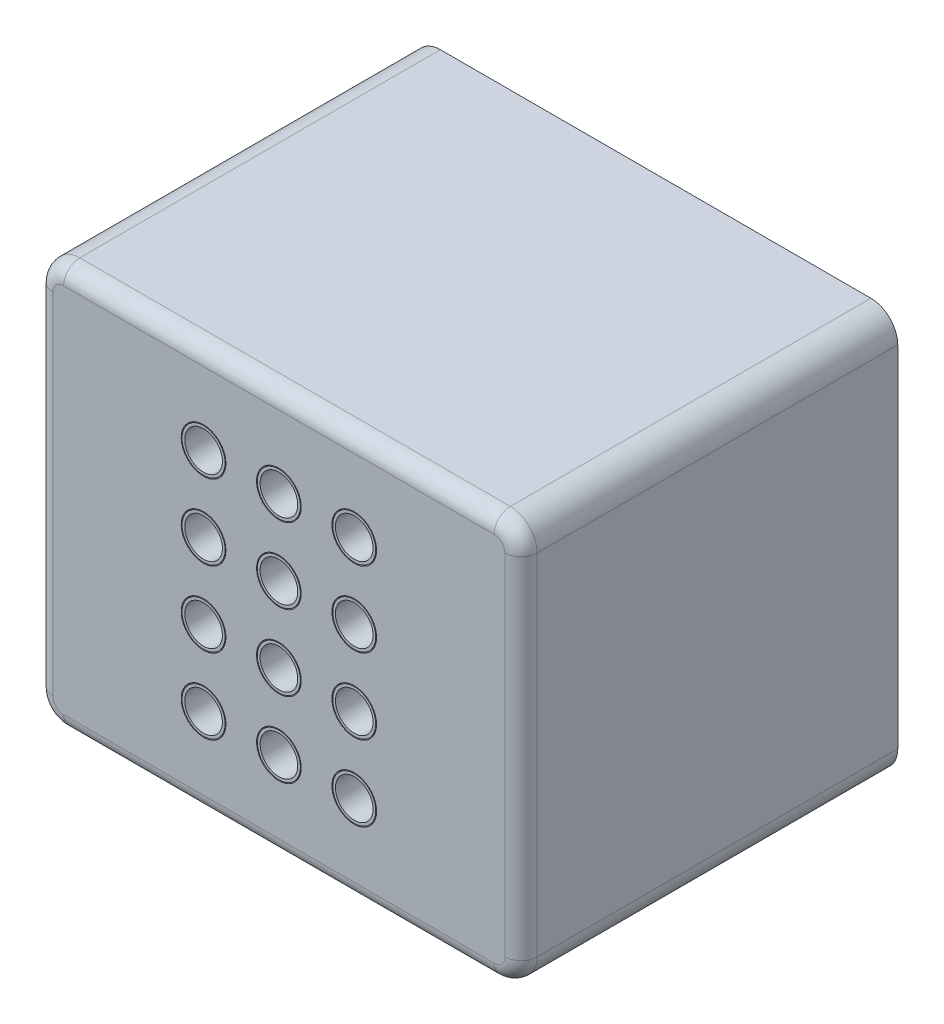
from build123d import *
from build123d.topology import SkipClean

# Parameters (mm, degrees)
SKETCH_1_W           = 90
SKETCH_1_H           = 75
EXTRUDE_1_DEPTH      = 43
SKETCH_2_R           = 4.15
CUT_EXTRUDE_3_DEPTH  = 80
SKETCH_8_W           = 85
SKETCH_8_H           = 70
CUT_EXTRUDE_4_DEPTH  = 37
SKETCH_9_R           = 6.5
SKETCH_9_R_2         = 4
EXTRUDE_5_DEPTH      = 22
SKETCH_12_W          = 3
SKETCH_12_H          = 10
CUT_EXTRUDE_5_DEPTH  = 4
SKETCH_13_R          = 4
SKETCH_13_R_2        = 1.25
EXTRUDE_7_DEPTH      = 22
SKETCH_15_R          = 4
SKETCH_15_R_2        = 3.5
EXTRUDE_8_DEPTH      = 5.8
EXTRUDE_8_2_DEPTH    = 5.8
EXTRUDE_8_3_DEPTH    = 5.8
EXTRUDE_8_4_DEPTH    = 5.8
EXTRUDE_8_5_DEPTH    = 5.8
EXTRUDE_8_6_DEPTH    = 5.8
EXTRUDE_8_7_DEPTH    = 5.8
EXTRUDE_8_8_DEPTH    = 5.8
EXTRUDE_8_9_DEPTH    = 5.8
EXTRUDE_8_10_DEPTH   = 5.8
EXTRUDE_8_11_DEPTH   = 5.8
EXTRUDE_8_12_DEPTH   = 5.8
FILLET_1_R           = 5
SKETCH_16_R          = 4.535533906
SKETCH_16_R_2        = 1.4
EXTRUDE_9_DEPTH      = 37
SKETCH_17_R          = 1.4
CUT_EXTRUDE_7_DEPTH  = 27
FILLET_3_R           = 3
SKETCH_18_R          = 6.5
CUT_EXTRUDE_8_DEPTH  = 10
SKETCH_24_W          = 13.5
SKETCH_24_H          = 8.5
CUT_EXTRUDE_12_DEPTH = 3
SKETCH_26_W          = 3
SKETCH_26_H          = 3
CUT_EXTRUDE_14_DEPTH = 21
EXTRUDE_START        = 27
SKETCH_27_R          = 1.4
EXTRUDE_10_DEPTH     = 27


with BuildPart() as part:
    # 草图1 → 凸台-拉伸1 (new body)
    with BuildSketch(Plane.XY):
        Rectangle(SKETCH_1_W, SKETCH_1_H)
    extrude(amount=EXTRUDE_1_DEPTH)

    # 草图2 → 切除-拉伸3 (cut)
    with BuildSketch(Plane.XY.offset(43)):
        with Locations((0, 7)):
            Circle(SKETCH_2_R)
        with Locations((0, -7)):
            Circle(SKETCH_2_R)
        with Locations((14, 7)):
            Circle(SKETCH_2_R)
        with Locations((14, -7)):
            Circle(SKETCH_2_R)
        with Locations((-14, -7)):
            Circle(SKETCH_2_R)
        with Locations((-14, 7)):
            Circle(SKETCH_2_R)
        with Locations((0, -21)):
            Circle(SKETCH_2_R)
        with Locations((-14, -21)):
            Circle(SKETCH_2_R)
        with Locations((14, -21)):
            Circle(SKETCH_2_R)
        with Locations((-14, 21)):
            Circle(SKETCH_2_R)
        with Locations((0, 21)):
            Circle(SKETCH_2_R)
        with Locations((14, 21)):
            Circle(SKETCH_2_R)
    extrude(amount=-CUT_EXTRUDE_3_DEPTH, mode=Mode.SUBTRACT)

    # 草图8 → 切除-拉伸4 (cut)
    with BuildSketch(Plane(origin=(0, 0, 0), x_dir=(-1, 0, 0), z_dir=(0, 0, -1))):
        Rectangle(SKETCH_8_W, SKETCH_8_H)
    extrude(amount=-CUT_EXTRUDE_4_DEPTH, mode=Mode.SUBTRACT)

    # 草图9 → 凸台-拉伸5 (add)
    # profile 1 of 12: a face of its own
    with BuildSketch(Plane(origin=(0, 0, 37), x_dir=(-1, 0, 0), z_dir=(0, 0, -1))):
        with Locations((-14, 7)):
            Circle(SKETCH_9_R)
        with Locations((-14, 7)):
            Circle(SKETCH_9_R_2, mode=Mode.SUBTRACT)
    # profile 2 of 12: a face of its own
    with BuildSketch(Plane(origin=(0, 0, 37), x_dir=(-1, 0, 0), z_dir=(0, 0, -1))):
        with Locations((0, 7)):
            Circle(SKETCH_9_R)
        with Locations((0, 7)):
            Circle(SKETCH_9_R_2, mode=Mode.SUBTRACT)
    # profile 3 of 12: a face of its own
    with BuildSketch(Plane(origin=(0, 0, 37), x_dir=(-1, 0, 0), z_dir=(0, 0, -1))):
        with Locations((14, 7)):
            Circle(SKETCH_9_R)
        with Locations((14, 7)):
            Circle(SKETCH_9_R_2, mode=Mode.SUBTRACT)
    # profile 4 of 12: a face of its own
    with BuildSketch(Plane(origin=(0, 0, 37), x_dir=(-1, 0, 0), z_dir=(0, 0, -1))):
        with Locations(Location((14, -7, 0), (0, 0, 180))):
            Circle(SKETCH_9_R)
        with Locations(Location((14, -7, 0), (0, 0, 180))):
            Circle(SKETCH_9_R_2, mode=Mode.SUBTRACT)
    # profile 5 of 12: a face of its own
    with BuildSketch(Plane(origin=(0, 0, 37), x_dir=(-1, 0, 0), z_dir=(0, 0, -1))):
        with Locations(Location((0, -7, 0), (0, 0, 180))):
            Circle(SKETCH_9_R)
        with Locations(Location((0, -7, 0), (0, 0, 180))):
            Circle(SKETCH_9_R_2, mode=Mode.SUBTRACT)
    # profile 6 of 12: a face of its own
    with BuildSketch(Plane(origin=(0, 0, 37), x_dir=(-1, 0, 0), z_dir=(0, 0, -1))):
        with Locations(Location((-14, -7, 0), (0, 0, 180))):
            Circle(SKETCH_9_R)
        with Locations(Location((-14, -7, 0), (0, 0, 180))):
            Circle(SKETCH_9_R_2, mode=Mode.SUBTRACT)
    # profile 7 of 12: a face of its own
    with BuildSketch(Plane(origin=(0, 0, 37), x_dir=(-1, 0, 0), z_dir=(0, 0, -1))):
        with Locations((-14, 21)):
            Circle(SKETCH_9_R)
        with Locations((-14, 21)):
            Circle(SKETCH_9_R_2, mode=Mode.SUBTRACT)
    # profile 8 of 12: a face of its own
    with BuildSketch(Plane(origin=(0, 0, 37), x_dir=(-1, 0, 0), z_dir=(0, 0, -1))):
        with Locations((0, 21)):
            Circle(SKETCH_9_R)
        with Locations((0, 21)):
            Circle(SKETCH_9_R_2, mode=Mode.SUBTRACT)
    # profile 9 of 12: a face of its own
    with BuildSketch(Plane(origin=(0, 0, 37), x_dir=(-1, 0, 0), z_dir=(0, 0, -1))):
        with Locations((14, 21)):
            Circle(SKETCH_9_R)
        with Locations((14, 21)):
            Circle(SKETCH_9_R_2, mode=Mode.SUBTRACT)
    # profile 10 of 12: a face of its own
    with BuildSketch(Plane(origin=(0, 0, 37), x_dir=(-1, 0, 0), z_dir=(0, 0, -1))):
        with Locations(Location((14, -21, 0), (0, 0, 180))):
            Circle(SKETCH_9_R)
        with Locations(Location((14, -21, 0), (0, 0, 180))):
            Circle(SKETCH_9_R_2, mode=Mode.SUBTRACT)
    # profile 11 of 12: a face of its own
    with BuildSketch(Plane(origin=(0, 0, 37), x_dir=(-1, 0, 0), z_dir=(0, 0, -1))):
        with Locations(Location((0, -21, 0), (0, 0, 180))):
            Circle(SKETCH_9_R)
        with Locations(Location((0, -21, 0), (0, 0, 180))):
            Circle(SKETCH_9_R_2, mode=Mode.SUBTRACT)
    # profile 12 of 12: a face of its own
    with BuildSketch(Plane(origin=(0, 0, 37), x_dir=(-1, 0, 0), z_dir=(0, 0, -1))):
        with Locations(Location((-14, -21, 0), (0, 0, 180))):
            Circle(SKETCH_9_R)
        with Locations(Location((-14, -21, 0), (0, 0, 180))):
            Circle(SKETCH_9_R_2, mode=Mode.SUBTRACT)
    extrude(amount=EXTRUDE_5_DEPTH)

    # 草图12 → 切除-拉伸5 (cut)
    with BuildSketch(Plane(origin=(0, 0, 15), x_dir=(-1, 0, 0), z_dir=(0, 0, -1))):
        with Locations((0, 13.5)):
            Rectangle(SKETCH_12_W, SKETCH_12_H)
        with Locations((14, 13.5)):
            Rectangle(SKETCH_12_W, SKETCH_12_H)
        with Locations((-14, 13.5)):
            Rectangle(SKETCH_12_W, SKETCH_12_H)
        with Locations((0, -12.5)):
            Rectangle(SKETCH_12_W, SKETCH_12_H)
        with Locations((14, -12.5)):
            Rectangle(SKETCH_12_W, SKETCH_12_H)
        with Locations((-14, -12.5)):
            Rectangle(SKETCH_12_W, SKETCH_12_H)
    extrude(amount=-CUT_EXTRUDE_5_DEPTH, mode=Mode.SUBTRACT)

    # 草图13 → 凸台-拉伸7 (add)
    # profile 1 of 4: a face of its own
    with BuildSketch(Plane(origin=(0, 0, 37), x_dir=(-1, 0, 0), z_dir=(0, 0, -1))):
        with Locations((-7, 0)):
            Circle(SKETCH_13_R)
        with Locations((-7, 0)):
            Circle(SKETCH_13_R_2, mode=Mode.SUBTRACT)
    # profile 2 of 4: a face of its own
    with BuildSketch(Plane(origin=(0, 0, 37), x_dir=(-1, 0, 0), z_dir=(0, 0, -1))):
        with Locations((19, 0)):
            Circle(SKETCH_13_R)
        with Locations(Location((19, 0, 0), (0, 0, 180))):
            Circle(SKETCH_13_R_2, mode=Mode.SUBTRACT)
    # profile 3 of 4: a face of its own
    with BuildSketch(Plane(origin=(0, 0, 37), x_dir=(-1, 0, 0), z_dir=(0, 0, -1))):
        with Locations((7, 0)):
            Circle(SKETCH_13_R)
        with Locations(Location((7, 0, 0), (0, 0, 180))):
            Circle(SKETCH_13_R_2, mode=Mode.SUBTRACT)
    # profile 4 of 4: a face of its own
    with BuildSketch(Plane(origin=(0, 0, 37), x_dir=(-1, 0, 0), z_dir=(0, 0, -1))):
        with Locations((-19, 0)):
            Circle(SKETCH_13_R)
        with Locations((-19, 0)):
            Circle(SKETCH_13_R_2, mode=Mode.SUBTRACT)
    extrude(amount=EXTRUDE_7_DEPTH)

    # 圆角1
    fillet_1_edges = [part.edges().sort_by_distance(p)[0] for p in [
        (45, -37.5, 21.5),
        (-45, -37.5, 21.5),
        (-45, 37.5, 21.5),
        (45, 37.5, 21.5),
        (-42.5, 35, 18.5),
        (-42.5, -35, 18.5),
        (42.5, -35, 18.5),
        (42.5, 35, 18.5),
    ]]
    fillet(fillet_1_edges, radius=FILLET_1_R)

    # 草图16 → 凸台-拉伸9 (add)
    # profile 1 of 4: a face of its own
    with BuildSketch(Plane(origin=(0, 0, 0), x_dir=(-1, 0, 0), z_dir=(0, 0, -1))):
        with Locations((-40.328427125, 32.828427125)):
            Circle(SKETCH_16_R)
        with Locations((-40.328427125, 32.828427125)):
            Circle(SKETCH_16_R_2, mode=Mode.SUBTRACT)
    # profile 2 of 4: a face of its own
    with BuildSketch(Plane(origin=(0, 0, 0), x_dir=(-1, 0, 0), z_dir=(0, 0, -1))):
        with Locations((40.328427125, 32.828427125)):
            Circle(SKETCH_16_R)
        with Locations((40.328427125, 32.828427125)):
            Circle(SKETCH_16_R_2, mode=Mode.SUBTRACT)
    # profile 3 of 4: a face of its own
    with BuildSketch(Plane(origin=(0, 0, 0), x_dir=(-1, 0, 0), z_dir=(0, 0, -1))):
        with Locations((40.328427125, -32.828427125)):
            Circle(SKETCH_16_R)
        with Locations((40.328427125, -32.828427125)):
            Circle(SKETCH_16_R_2, mode=Mode.SUBTRACT)
    # profile 4 of 4: a face of its own
    with BuildSketch(Plane(origin=(0, 0, 0), x_dir=(-1, 0, 0), z_dir=(0, 0, -1))):
        with Locations((-40.328427125, -32.828427125)):
            Circle(SKETCH_16_R)
        with Locations((-40.328427125, -32.828427125)):
            Circle(SKETCH_16_R_2, mode=Mode.SUBTRACT)
    extrude(amount=-EXTRUDE_9_DEPTH)

    # 草图17 → 切除-拉伸7 (cut)
    with BuildSketch(Plane(origin=(0, 0, 0), x_dir=(-1, 0, 0), z_dir=(0, 0, -1))):
        with Locations((-40.328427125, 32.828427125)):
            Circle(SKETCH_17_R)
        with Locations(Location((40.328427125, 32.828427125, 0), (0, 0, 353.944803594))):
            Circle(SKETCH_17_R)
        with Locations((40.328427125, -32.828427125)):
            Circle(SKETCH_17_R)
        with Locations(Location((-40.328427125, -32.828427125, 0), (0, 0, 276.055196406))):
            Circle(SKETCH_17_R)
    extrude(amount=-CUT_EXTRUDE_7_DEPTH, mode=Mode.SUBTRACT)

    # 圆角3
    fillet_3_edges = [part.edges().sort_by_distance(p)[0] for p in [
        (45, 0, 43),
        (0, -37.5, 43),
        (0, 37.5, 43),
        (-45, 0, 43),
        (43.535533906, 36.035533906, 43),
        (-43.535533906, 36.035533906, 43),
        (-43.535533906, -36.035533906, 43),
        (43.535533906, -36.035533906, 43),
    ]]
    fillet(fillet_3_edges, radius=FILLET_3_R)

    # 草图18 → 切除-拉伸8 (cut)
    with BuildSketch(Plane.XZ.offset(37.5)):
        with Locations(Location((25, 20, 0), (0, 0, 270))):
            Circle(SKETCH_18_R)
    extrude(amount=-CUT_EXTRUDE_8_DEPTH, mode=Mode.SUBTRACT)

    # 草图24 → 切除-拉伸12 (cut)
    with BuildSketch(Plane.XZ.offset(37.5)):
        with Locations((-25, 20)):
            Rectangle(SKETCH_24_W, SKETCH_24_H)
    extrude(amount=-CUT_EXTRUDE_12_DEPTH, mode=Mode.SUBTRACT)

    # 草图26 → 切除-拉伸14 (cut)
    with BuildSketch(Plane(origin=(0, 0, 15), x_dir=(-1, 0, 0), z_dir=(0, 0, -1))):
        with Locations((-14, 17)):
            Rectangle(SKETCH_26_W, SKETCH_26_H)
        with Locations((0, 17)):
            Rectangle(SKETCH_26_W, SKETCH_26_H)
        with Locations((14, 17)):
            Rectangle(SKETCH_26_W, SKETCH_26_H)
        with Locations((-14, 11)):
            Rectangle(SKETCH_26_W, SKETCH_26_H)
        with Locations((0, 11)):
            Rectangle(SKETCH_26_W, SKETCH_26_H)
        with Locations((14, 11)):
            Rectangle(SKETCH_26_W, SKETCH_26_H)
        with Locations((14, -11)):
            Rectangle(SKETCH_26_W, SKETCH_26_H)
        with Locations((0, -11)):
            Rectangle(SKETCH_26_W, SKETCH_26_H)
        with Locations((-14, -11)):
            Rectangle(SKETCH_26_W, SKETCH_26_H)
        with Locations((14, -17)):
            Rectangle(SKETCH_26_W, SKETCH_26_H)
        with Locations((0, -17)):
            Rectangle(SKETCH_26_W, SKETCH_26_H)
        with Locations((-14, -17)):
            Rectangle(SKETCH_26_W, SKETCH_26_H)
    extrude(amount=-CUT_EXTRUDE_14_DEPTH, mode=Mode.SUBTRACT)

    # 草图27 → 凸台-拉伸10 (add)
    with SkipClean():  # the faces are left unmerged after this step: merging them gives an invalid solid
        with BuildSketch(Plane(origin=(0, 0, 0), x_dir=(-1, 0, 0), z_dir=(0, 0, -1)).offset(EXTRUDE_START)):
            with BuildLine():
                Line((-40, -37.5), (40, -37.5))
                ThreePointArc((40, -37.5), (43.535533906, -36.035533906), (45, -32.5))
                Line((45, -32.5), (45, 32.5))
                ThreePointArc((45, 32.5), (43.535533906, 36.035533906), (40, 37.5))
                Line((40, 37.5), (-40, 37.5))
                ThreePointArc((-40, 37.5), (-43.535533906, 36.035533906), (-45, 32.5))
                Line((-45, 32.5), (-45, -32.5))
                ThreePointArc((-45, -32.5), (-43.535533906, -36.035533906), (-40, -37.5))
            make_face()
            with Locations((-40.328427125, 32.828427125)):
                Circle(SKETCH_27_R, mode=Mode.SUBTRACT)
            with Locations((40.328427125, 32.828427125)):
                Circle(SKETCH_27_R, mode=Mode.SUBTRACT)
            with Locations((-40.328427125, -32.828427125)):
                Circle(SKETCH_27_R, mode=Mode.SUBTRACT)
            with Locations((40.328427125, -32.828427125)):
                Circle(SKETCH_27_R, mode=Mode.SUBTRACT)
            with BuildLine():
                Line((36.346550801, 35), (-36.346550801, 35))
                ThreePointArc((-36.346550801, 35), (-37.121320344, 29.621320344), (-42.5, 28.846550801))
                Line((-42.5, 28.846550801), (-42.5, -28.846550801))
                ThreePointArc((-42.5, -28.846550801), (-37.121320344, -29.621320344), (-36.346550801, -35))
                Line((-36.346550801, -35), (36.346550801, -35))
                ThreePointArc((36.346550801, -35), (37.121320344, -29.621320344), (42.5, -28.846550801))
                Line((42.5, -28.846550801), (42.5, 28.846550801))
                ThreePointArc((42.5, 28.846550801), (37.121320344, 29.621320344), (36.346550801, 35))
            make_face(mode=Mode.SUBTRACT)
        extrude(amount=-EXTRUDE_10_DEPTH)


with BuildPart() as body_2:
    # 草图15 → 凸台-拉伸8 (new body)
    with BuildSketch(Plane.XY.offset(43)):
        with Locations((-14, 7)):
            Circle(SKETCH_15_R)
        with Locations((-14, 7)):
            Circle(SKETCH_15_R_2, mode=Mode.SUBTRACT)
    extrude(amount=-EXTRUDE_8_DEPTH)


with BuildPart() as body_3:
    # 草图15 → Extrude 8 2 (new body)
    with BuildSketch(Plane.XY.offset(43)):
        with Locations((0, 7)):
            Circle(SKETCH_15_R)
        with Locations((0, 7)):
            Circle(SKETCH_15_R_2, mode=Mode.SUBTRACT)
    extrude(amount=-EXTRUDE_8_2_DEPTH)


with BuildPart() as body_4:
    # 草图15 → Extrude 8 3 (new body)
    with BuildSketch(Plane.XY.offset(43)):
        with Locations((14, 7)):
            Circle(SKETCH_15_R)
        with Locations((14, 7)):
            Circle(SKETCH_15_R_2, mode=Mode.SUBTRACT)
    extrude(amount=-EXTRUDE_8_3_DEPTH)


with BuildPart() as body_5:
    # 草图15 → Extrude 8 4 (new body)
    with BuildSketch(Plane.XY.offset(43)):
        with Locations((14, -7)):
            Circle(SKETCH_15_R)
        with Locations(Location((14, -7, 0), (0, 0, 180))):
            Circle(SKETCH_15_R_2, mode=Mode.SUBTRACT)
    extrude(amount=-EXTRUDE_8_4_DEPTH)


with BuildPart() as body_6:
    # 草图15 → Extrude 8 5 (new body)
    with BuildSketch(Plane.XY.offset(43)):
        with Locations((0, -7)):
            Circle(SKETCH_15_R)
        with Locations(Location((0, -7, 0), (0, 0, 180))):
            Circle(SKETCH_15_R_2, mode=Mode.SUBTRACT)
    extrude(amount=-EXTRUDE_8_5_DEPTH)


with BuildPart() as body_7:
    # 草图15 → Extrude 8 6 (new body)
    with BuildSketch(Plane.XY.offset(43)):
        with Locations((-14, -7)):
            Circle(SKETCH_15_R)
        with Locations(Location((-14, -7, 0), (0, 0, 180))):
            Circle(SKETCH_15_R_2, mode=Mode.SUBTRACT)
    extrude(amount=-EXTRUDE_8_6_DEPTH)


with BuildPart() as body_8:
    # 草图15 → Extrude 8 7 (new body)
    with BuildSketch(Plane.XY.offset(43)):
        with Locations((-14, 21)):
            Circle(SKETCH_15_R)
        with Locations((-14, 21)):
            Circle(SKETCH_15_R_2, mode=Mode.SUBTRACT)
    extrude(amount=-EXTRUDE_8_7_DEPTH)


with BuildPart() as body_9:
    # 草图15 → Extrude 8 8 (new body)
    with BuildSketch(Plane.XY.offset(43)):
        with Locations((0, 21)):
            Circle(SKETCH_15_R)
        with Locations((0, 21)):
            Circle(SKETCH_15_R_2, mode=Mode.SUBTRACT)
    extrude(amount=-EXTRUDE_8_8_DEPTH)


with BuildPart() as body_10:
    # 草图15 → Extrude 8 9 (new body)
    with BuildSketch(Plane.XY.offset(43)):
        with Locations((14, 21)):
            Circle(SKETCH_15_R)
        with Locations((14, 21)):
            Circle(SKETCH_15_R_2, mode=Mode.SUBTRACT)
    extrude(amount=-EXTRUDE_8_9_DEPTH)


with BuildPart() as body_11:
    # 草图15 → Extrude 8 10 (new body)
    with BuildSketch(Plane.XY.offset(43)):
        with Locations(Location((14, -21, 0), (0, 0, 180))):
            Circle(SKETCH_15_R)
        with Locations(Location((14, -21, 0), (0, 0, 180))):
            Circle(SKETCH_15_R_2, mode=Mode.SUBTRACT)
    extrude(amount=-EXTRUDE_8_10_DEPTH)


with BuildPart() as body_12:
    # 草图15 → Extrude 8 11 (new body)
    with BuildSketch(Plane.XY.offset(43)):
        with Locations(Location((0, -21, 0), (0, 0, 180))):
            Circle(SKETCH_15_R)
        with Locations(Location((0, -21, 0), (0, 0, 180))):
            Circle(SKETCH_15_R_2, mode=Mode.SUBTRACT)
    extrude(amount=-EXTRUDE_8_11_DEPTH)


with BuildPart() as body_13:
    # 草图15 → Extrude 8 12 (new body)
    with BuildSketch(Plane.XY.offset(43)):
        with Locations(Location((-14, -21, 0), (0, 0, 180))):
            Circle(SKETCH_15_R)
        with Locations(Location((-14, -21, 0), (0, 0, 180))):
            Circle(SKETCH_15_R_2, mode=Mode.SUBTRACT)
    extrude(amount=-EXTRUDE_8_12_DEPTH)


solid = Compound([part.part, body_2.part, body_3.part, body_4.part, body_5.part, body_6.part, body_7.part, body_8.part, body_9.part, body_10.part, body_11.part, body_12.part, body_13.part])
